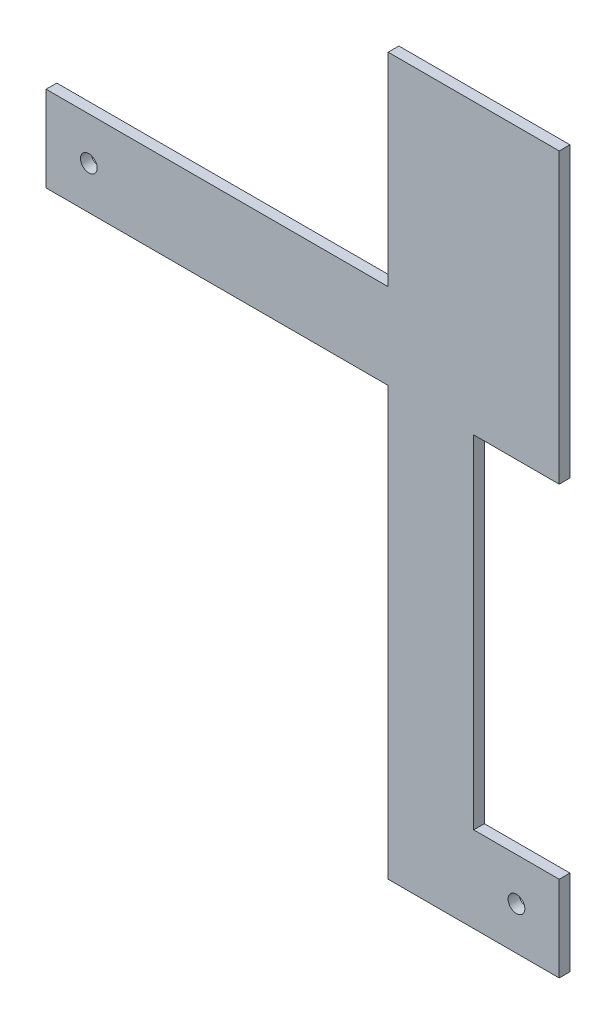
from build123d import *

# Parameters (mm, degrees)
BOSS_EXTRUDE1_DEPTH        = 3.175
F_9_0_196_DIAMETER_HOLE1_D = 4.9784


with BuildPart() as part:
    # Sketch1 → Boss-Extrude1 (new body)
    with BuildSketch(Plane(origin=(0, 0, 0), x_dir=(0, 1, 0), z_dir=(0, 0, 1))):
        Polygon((-80.9625, -12.7), (-80.9625, -38.1), (-106.3625, -38.1), (-106.3625, 12.7), (20.6375, 12.7), (20.6375, 114.3), (46.0375, 114.3), (46.0375, 12.7), (106.3625, 12.7), (106.3625, -38.1), (20.6375, -38.1), (20.6375, -12.7), align=None)
    extrude(amount=BOSS_EXTRUDE1_DEPTH)

    # #9 (0.196) Diameter Hole1 (through all)
    with Locations(Plane.XY.offset(3.175)):
        with Locations((25.4, -93.6625), (-153.251995768, -35.15541816), (-101.6, 33.3375), (-174.461563536, 15.375329004)):
            Hole(F_9_0_196_DIAMETER_HOLE1_D / 2)


solid = part.part
